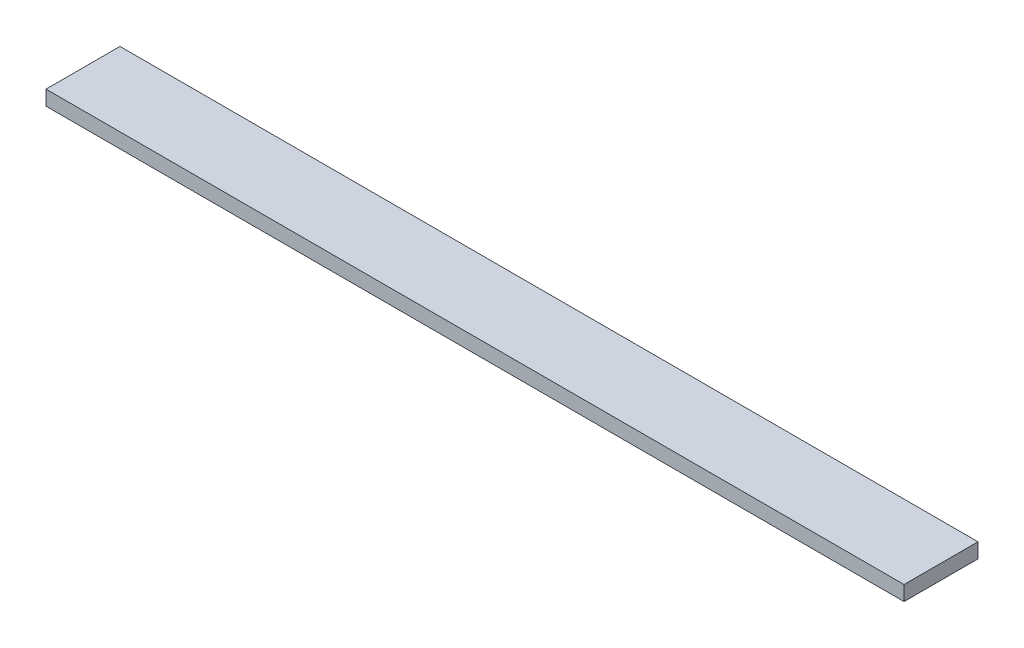
from build123d import *

# Parameters (mm, degrees)
SKETCH1_W           = 294.64
SKETCH1_H           = 25.4
BOSS_EXTRUDE1_DEPTH = 5.08


with BuildPart() as part:
    # Sketch1 → Boss-Extrude1 (new body)
    with BuildSketch(Plane(origin=(0, 0, 0), x_dir=(1, 0, 0), z_dir=(0, 1, 0))):
        Rectangle(SKETCH1_W, SKETCH1_H)
    extrude(amount=BOSS_EXTRUDE1_DEPTH)


solid = part.part
